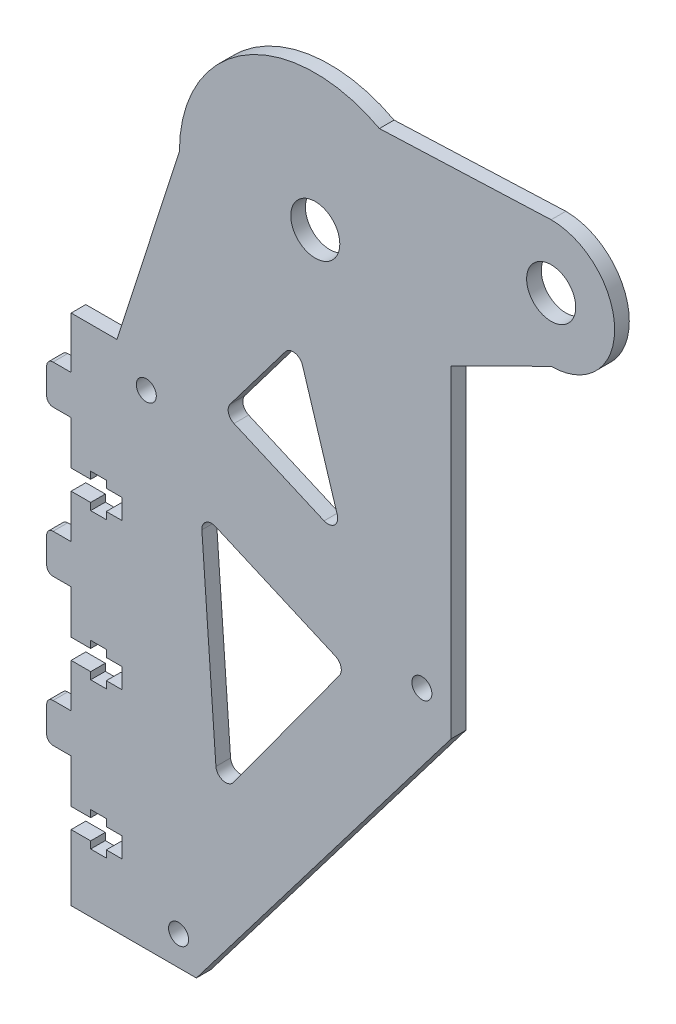
from build123d import *

# Parameters (mm, degrees)
SKETCH_1_R      = 5.0225
SKETCH_1_R_2    = 2.05
EXTRUDE_1_DEPTH = 3
FILLET_1_R      = 2
FILLET_2_R      = 1.3
SKETCH_3_R      = 5.025
EXTRUDE_2_DEPTH = 3


with BuildPart() as part:
    # 草图1 → 凸台-拉伸1 (new body)
    with BuildSketch(Plane.XY):
        with BuildLine():
            Line((298.545628784, -83.894391363), (298.545628784, -92.841778663))
            Line((298.545628784, -92.841778663), (302.545628784, -92.841778663))
            Line((302.545628784, -92.841778663), (302.545628784, -91.391778663))
            Line((302.545628784, -91.391778663), (305.745628784, -91.391778663))
            Line((305.745628784, -91.391778663), (305.745628784, -92.841778663))
            Line((305.745628784, -92.841778663), (308.945628784, -92.841778663))
            Line((308.945628784, -92.841778663), (308.945628784, -96.941778663))
            Line((308.945628784, -96.941778663), (305.745628784, -96.941778663))
            Line((305.745628784, -96.941778663), (305.745628784, -98.391778663))
            Line((305.745628784, -98.391778663), (302.545628784, -98.391778663))
            Line((302.545628784, -98.391778663), (302.545628784, -96.941778663))
            Line((302.545628784, -96.941778663), (298.545628784, -96.941778663))
            Line((298.545628784, -96.941778663), (298.545628784, -105.894391358))
            Line((298.545628784, -105.894391358), (293.545628784, -105.894391358))
            Line((293.545628784, -105.894391358), (293.545628784, -113.894391358))
            Line((293.545628784, -113.894391358), (298.545628784, -113.894391358))
            Line((298.545628784, -113.894391358), (298.545628784, -122.847004054))
            Line((298.545628784, -122.847004054), (302.545628784, -122.847004054))
            Line((302.545628784, -122.847004054), (302.545628784, -121.397004054))
            Line((302.545628784, -121.397004054), (305.745628784, -121.397004054))
            Line((305.745628784, -121.397004054), (305.745628784, -122.847004054))
            Line((305.745628784, -122.847004054), (308.945628784, -122.847004054))
            Line((308.945628784, -122.847004054), (308.945628784, -126.947004054))
            Line((308.945628784, -126.947004054), (305.745628784, -126.947004054))
            Line((305.745628784, -126.947004054), (305.745628784, -128.397004054))
            Line((305.745628784, -128.397004054), (302.545628784, -128.397004054))
            Line((302.545628784, -128.397004054), (302.545628784, -126.947004054))
            Line((302.545628784, -126.947004054), (298.545628784, -126.947004054))
            Line((298.545628784, -126.947004054), (298.545628784, -140.447004054))
            Line((298.545628784, -140.447004054), (324.188862368, -140.447004054))
            Line((324.188862368, -140.447004054), (376.358604426, -71.946984141))
            Line((376.358604426, -71.946984141), (376.358604426, 4.396201153))
            ThreePointArc((376.358604426, 4.396201153), (348.536987634, 32.217817945), (320.715370843, 4.396201153))
            Line((320.715370843, 4.396201153), (307.936987634, -35.346984141))
            Line((307.936987634, -35.346984141), (298.545628784, -35.346984141))
            Line((298.545628784, -35.346984141), (298.545628784, -45.889165972))
            Line((298.545628784, -45.889165972), (293.545628784, -45.889165972))
            Line((293.545628784, -45.889165972), (293.545628784, -53.889165972))
            Line((293.545628784, -53.889165972), (298.545628784, -53.889165972))
            Line((298.545628784, -53.889165972), (298.545628784, -62.841778668))
            Line((298.545628784, -62.841778668), (302.545628784, -62.841778668))
            Line((302.545628784, -62.841778668), (302.545628784, -61.391778668))
            Line((302.545628784, -61.391778668), (305.745628784, -61.391778668))
            Line((305.745628784, -61.391778668), (305.745628784, -62.841778668))
            Line((305.745628784, -62.841778668), (308.945628784, -62.841778668))
            Line((308.945628784, -62.841778668), (308.945628784, -66.941778668))
            Line((308.945628784, -66.941778668), (305.745628784, -66.941778668))
            Line((305.745628784, -66.941778668), (305.745628784, -68.391778668))
            Line((305.745628784, -68.391778668), (302.545628784, -68.391778668))
            Line((302.545628784, -68.391778668), (302.545628784, -66.941778668))
            Line((302.545628784, -66.941778668), (298.545628784, -66.941778668))
            Line((298.545628784, -66.941778668), (298.545628784, -75.894391363))
            Line((298.545628784, -75.894391363), (293.545628784, -75.894391363))
            Line((293.545628784, -75.894391363), (293.545628784, -83.894391363))
            Line((293.545628784, -83.894391363), (298.545628784, -83.894391363))
        make_face()
        with Locations((348.536987634, 4.396201153)):
            Circle(SKETCH_1_R, mode=Mode.SUBTRACT)
        with Locations((320.545628784, -134.447004054)):
            Circle(SKETCH_1_R_2, mode=Mode.SUBTRACT)
        with Locations((370.358604426, -65.946984141)):
            Circle(SKETCH_1_R_2, mode=Mode.SUBTRACT)
        with Locations((313.936987634, -41.346984141)):
            Circle(SKETCH_1_R_2, mode=Mode.SUBTRACT)
        Polygon((354.947285032, -70.136765586), (328.579617375, -106.396108383), (325.08144343, -57.115165973), align=None, mode=Mode.SUBTRACT)
        Polygon((329.571126451, -37.254352656), (354.337315751, -48.052488042), (344.758747766, -17.175445836), align=None, mode=Mode.SUBTRACT)
    extrude(amount=EXTRUDE_1_DEPTH)

    # 圆角1
    fillet_1_edges = [part.edges().sort_by_distance(p)[0] for p in [
        (354.947285032, -70.136765586, 1.5),
        (325.08144343, -57.115165973, 1.5),
        (328.579617375, -106.396108383, 1.5),
        (344.758747766, -17.175445836, 1.5),
        (329.571126451, -37.254352656, 1.5),
        (354.337315751, -48.052488042, 1.5),
    ]]
    fillet(fillet_1_edges, radius=FILLET_1_R)

    # 圆角2
    fillet_2_edges = [part.edges().sort_by_distance(p)[0] for p in [
        (293.545628784, -113.894391358, 1.5),
        (293.545628784, -105.894391358, 1.5),
        (293.545628784, -83.894391363, 1.5),
        (293.545628784, -75.894391363, 1.5),
        (293.545628784, -53.889165972, 1.5),
        (293.545628784, -45.889165972, 1.5),
    ]]
    fillet(fillet_2_edges, radius=FILLET_2_R)

    # 草图3 → 凸台-拉伸2 (add)
    with BuildSketch(Plane(origin=(0, 0, 0), x_dir=(-1, 0, 0), z_dir=(0, 0, -1))):
        with BuildLine():
            Line((-348.536987634, 28.396201153), (-396.833278949, 30.337153408))
            ThreePointArc((-396.833278949, 30.337153408), (-409.833278949, 17.337153408), (-396.833278949, 4.337153408))
            Line((-396.833278949, 4.337153408), (-348.536987634, -19.603798847))
            Line((-348.536987634, -19.603798847), (-372.536987634, 4.396201153))
            Line((-372.536987634, 4.396201153), (-348.536987634, 28.396201153))
        make_face()
        with Locations((-396.833278949, 17.337153408)):
            Circle(SKETCH_3_R, mode=Mode.SUBTRACT)
    extrude(amount=-EXTRUDE_2_DEPTH)


solid = part.part
